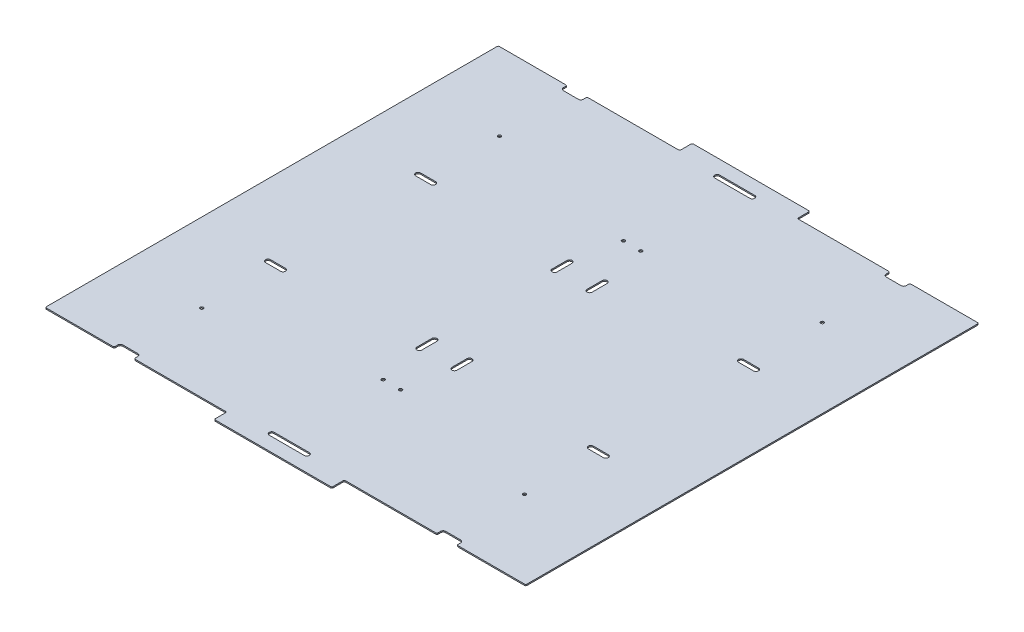
from build123d import *

# Parameters (mm, degrees)
SKETCH1_W                      = 1219.2
SKETCH1_H                      = 1219.2
BOSS_EXTRUDE1_DEPTH            = 3.175
F_5_16_0_3125_DIAMETER_HOLE1_D = 7.9375
SKETCH5_W                      = 460.375
SKETCH5_H                      = 34.925
CUT_EXTRUDE1_DEPTH             = 863.110434124
CUT_EXTRUDE2_DEPTH             = 863.110434124
SKETCH8_W                      = 50.8
SKETCH8_H                      = 9.525
CUT_EXTRUDE3_DEPTH             = 863.110434124
SKETCH9_W                      = 298.45
SKETCH9_H                      = 3.175
CUT_EXTRUDE4_DEPTH             = 863.110434124
FILLET1_R                      = 3.175


with BuildPart() as part:
    # Sketch1 → Boss-Extrude1 (new body)
    with BuildSketch(Plane(origin=(0, 0, 0), x_dir=(1, 0, 0), z_dir=(0, 1, 0))):
        Rectangle(SKETCH1_W, SKETCH1_H)
    extrude(amount=BOSS_EXTRUDE1_DEPTH)

    # 5/16 (0.3125) Diameter Hole1 (through all)
    with Locations(Plane(origin=(0, 3.175, 0), x_dir=(1, 0, 0), z_dir=(0, 1, 0))):
        with Locations((-409.575, 377.825), (-22.225, 304.8), (22.225, 304.8), (409.575, 377.825), (-22.225, -304.8), (-409.575, -377.825), (409.575, -377.825), (22.225, -304.8)):
            Hole(F_5_16_0_3125_DIAMETER_HOLE1_D / 2)

    # Sketch5 → Cut-Extrude1 (cut, through all)
    with BuildSketch(Plane(origin=(0, 3.175, 0), x_dir=(1, 0, 0), z_dir=(0, 1, 0))):
        with Locations((-379.4125, 592.1375)):
            Rectangle(SKETCH5_W, SKETCH5_H)
        with Locations((379.4125, 592.1375)):
            Rectangle(SKETCH5_W, SKETCH5_H)
        with Locations((379.4125, -592.1375)):
            Rectangle(SKETCH5_W, SKETCH5_H)
        with Locations((-379.4125, -592.1375)):
            Rectangle(SKETCH5_W, SKETCH5_H)
    extrude(amount=-CUT_EXTRUDE1_DEPTH, mode=Mode.SUBTRACT)

    # Sketch7 → Cut-Extrude2 (cut, through all)
    with BuildSketch(Plane(origin=(0, 3.175, 0), x_dir=(1, 0, 0), z_dir=(0, 1, 0))):
        with BuildLine():
            Line((-428.625, 571.5), (-390.525, 571.5))
            ThreePointArc((-390.525, 571.5), (-384.175, 565.15), (-390.525, 558.8))
            Line((-390.525, 558.8), (-428.625, 558.8))
            ThreePointArc((-428.625, 558.8), (-434.975, 565.15), (-428.625, 571.5))
        make_face()
        with BuildLine():
            Line((-428.625, 196.85), (-390.525, 196.85))
            ThreePointArc((-390.525, 196.85), (-384.175, 190.5), (-390.525, 184.15))
            Line((-390.525, 184.15), (-428.625, 184.15))
            ThreePointArc((-428.625, 184.15), (-434.975, 190.5), (-428.625, 196.85))
        make_face()
        with BuildLine():
            Line((-38.1, 190.5), (-38.1, 152.4))
            ThreePointArc((-38.1, 152.4), (-44.45, 146.05), (-50.8, 152.4))
            Line((-50.8, 152.4), (-50.8, 190.5))
            ThreePointArc((-50.8, 190.5), (-44.45, 196.85), (-38.1, 190.5))
        make_face()
        with BuildLine():
            Line((-428.625, -571.5), (-390.525, -571.5))
            ThreePointArc((-390.525, -571.5), (-384.175, -565.15), (-390.525, -558.8))
            Line((-390.525, -558.8), (-428.625, -558.8))
            ThreePointArc((-428.625, -558.8), (-434.975, -565.15), (-428.625, -571.5))
        make_face()
        with BuildLine():
            Line((-428.625, -196.85), (-390.525, -196.85))
            ThreePointArc((-390.525, -196.85), (-384.175, -190.5), (-390.525, -184.15))
            Line((-390.525, -184.15), (-428.625, -184.15))
            ThreePointArc((-428.625, -184.15), (-434.975, -190.5), (-428.625, -196.85))
        make_face()
        with BuildLine():
            Line((-38.1, -190.5), (-38.1, -152.4))
            ThreePointArc((-38.1, -152.4), (-44.45, -146.05), (-50.8, -152.4))
            Line((-50.8, -152.4), (-50.8, -190.5))
            ThreePointArc((-50.8, -190.5), (-44.45, -196.85), (-38.1, -190.5))
        make_face()
        with BuildLine():
            Line((428.625, 571.5), (390.525, 571.5))
            ThreePointArc((390.525, 571.5), (384.175, 565.15), (390.525, 558.8))
            Line((390.525, 558.8), (428.625, 558.8))
            ThreePointArc((428.625, 558.8), (434.975, 565.15), (428.625, 571.5))
        make_face()
        with BuildLine():
            Line((428.625, 196.85), (390.525, 196.85))
            ThreePointArc((390.525, 196.85), (384.175, 190.5), (390.525, 184.15))
            Line((390.525, 184.15), (428.625, 184.15))
            ThreePointArc((428.625, 184.15), (434.975, 190.5), (428.625, 196.85))
        make_face()
        with BuildLine():
            Line((-44.45, 571.5), (44.45, 571.5))
            ThreePointArc((44.45, 571.5), (50.8, 565.15), (44.45, 558.8))
            Line((44.45, 558.8), (-44.45, 558.8))
            ThreePointArc((-44.45, 558.8), (-50.8, 565.15), (-44.45, 571.5))
        make_face()
        with BuildLine():
            Line((38.1, 190.5), (38.1, 152.4))
            ThreePointArc((38.1, 152.4), (44.45, 146.05), (50.8, 152.4))
            Line((50.8, 152.4), (50.8, 190.5))
            ThreePointArc((50.8, 190.5), (44.45, 196.85), (38.1, 190.5))
        make_face()
        with BuildLine():
            Line((428.625, -571.5), (390.525, -571.5))
            ThreePointArc((390.525, -571.5), (384.175, -565.15), (390.525, -558.8))
            Line((390.525, -558.8), (428.625, -558.8))
            ThreePointArc((428.625, -558.8), (434.975, -565.15), (428.625, -571.5))
        make_face()
        with BuildLine():
            Line((428.625, -196.85), (390.525, -196.85))
            ThreePointArc((390.525, -196.85), (384.175, -190.5), (390.525, -184.15))
            Line((390.525, -184.15), (428.625, -184.15))
            ThreePointArc((428.625, -184.15), (434.975, -190.5), (428.625, -196.85))
        make_face()
        with BuildLine():
            Line((38.1, -190.5), (38.1, -152.4))
            ThreePointArc((38.1, -152.4), (44.45, -146.05), (50.8, -152.4))
            Line((50.8, -152.4), (50.8, -190.5))
            ThreePointArc((50.8, -190.5), (44.45, -196.85), (38.1, -190.5))
        make_face()
        with BuildLine():
            Line((-44.45, -558.8), (44.45, -558.8))
            ThreePointArc((44.45, -558.8), (50.8, -565.15), (44.45, -571.5))
            Line((44.45, -571.5), (-44.45, -571.5))
            ThreePointArc((-44.45, -571.5), (-50.8, -565.15), (-44.45, -558.8))
        make_face()
    extrude(amount=-CUT_EXTRUDE2_DEPTH, mode=Mode.SUBTRACT)

    # Sketch8 → Cut-Extrude3 (cut, through all)
    with BuildSketch(Plane(origin=(0, 3.175, 0), x_dir=(1, 0, 0), z_dir=(0, 1, 0))):
        with Locations((-409.575, -569.9125)):
            Rectangle(SKETCH8_W, SKETCH8_H)
        with Locations((409.575, -569.9125)):
            Rectangle(SKETCH8_W, SKETCH8_H)
        with Locations((409.575, 569.9125)):
            Rectangle(SKETCH8_W, SKETCH8_H)
        with Locations((-409.575, 569.9125)):
            Rectangle(SKETCH8_W, SKETCH8_H)
    extrude(amount=-CUT_EXTRUDE3_DEPTH, mode=Mode.SUBTRACT)

    # Sketch9 → Cut-Extrude4 (cut, through all)
    with BuildSketch(Plane.XZ):
        with Locations((0, 608.0125)):
            Rectangle(SKETCH9_W, SKETCH9_H)
        with Locations((0, -608.0125)):
            Rectangle(SKETCH9_W, SKETCH9_H)
    extrude(amount=-CUT_EXTRUDE4_DEPTH, mode=Mode.SUBTRACT)

    # Fillet1
    fillet1_edges = [part.edges().sort_by_distance(p)[0] for p in [
        (-434.975, 1.5875, -574.675),
        (-384.175, 1.5875, -574.675),
        (434.975, 1.5875, -574.675),
        (384.175, 1.5875, -574.675),
        (434.975, 1.5875, 574.675),
        (384.175, 1.5875, 574.675),
        (-434.975, 1.5875, 574.675),
        (-384.175, 1.5875, 574.675),
        (-149.225, 1.5875, 606.425),
        (149.225, 1.5875, 606.425),
        (-149.225, 1.5875, -606.425),
        (149.225, 1.5875, -606.425),
        (-609.6, 1.5875, 574.675),
        (-149.225, 1.5875, 574.675),
        (149.225, 1.5875, 574.675),
        (609.6, 1.5875, 574.675),
        (609.6, 1.5875, -574.675),
        (149.225, 1.5875, -574.675),
        (-149.225, 1.5875, -574.675),
        (-609.6, 1.5875, -574.675),
    ]]
    fillet(fillet1_edges, radius=FILLET1_R)


solid = part.part
